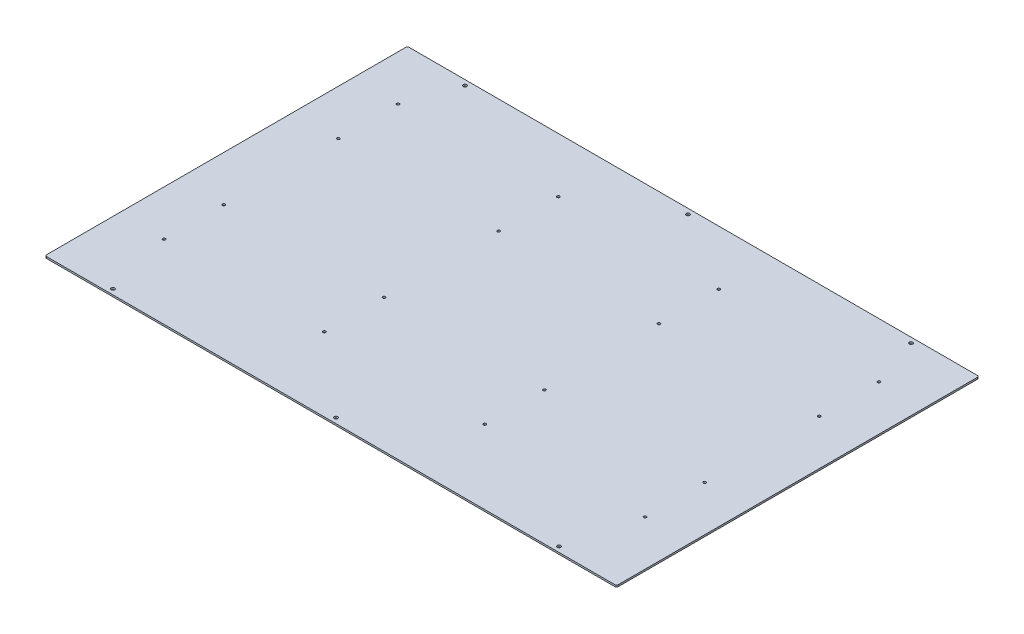
from build123d import *

# Parameters (mm, degrees)
BOSS_EXTRUDE1_DEPTH          = 3.175
F_1_4_0_25_DIAMETER_HOLE1_D  = 6.35
F_10_0_1935_DIAMETER_HOLE1_D = 4.9149


with BuildPart() as part:
    # Sketch1 → Boss-Extrude1 (new body)
    with BuildSketch(Plane(origin=(0, 0, 0), x_dir=(1, 0, 0), z_dir=(0, 1, 0))):
        with BuildLine():
            Line((-517.525, -330.2), (517.525, -330.2))
            ThreePointArc((517.525, -330.2), (519.77006403, -329.27006403), (520.7, -327.025))
            Line((520.7, -327.025), (520.7, 327.025))
            ThreePointArc((520.7, 327.025), (519.77006403, 329.27006403), (517.525, 330.2))
            Line((517.525, 330.2), (-517.525, 330.2))
            ThreePointArc((-517.525, 330.2), (-519.77006403, 329.27006403), (-520.7, 327.025))
            Line((-520.7, 327.025), (-520.7, -327.025))
            ThreePointArc((-520.7, -327.025), (-519.77006403, -329.27006403), (-517.525, -330.2))
        make_face()
    extrude(amount=BOSS_EXTRUDE1_DEPTH)

    # 1/4 (0.25) Diameter Hole1 (through all)
    with Locations(Plane(origin=(0, 3.175, 0), x_dir=(1, 0, 0), z_dir=(0, 1, 0))):
        with Locations((-406.4, 320.675), (0, 320.675), (406.4, 320.675), (406.4, -320.675), (0, -320.675), (-406.4, -320.675)):
            Hole(F_1_4_0_25_DIAMETER_HOLE1_D / 2)

    # #10 (0.1935) Diameter Hole1 (through all)
    with Locations(Plane(origin=(-438.15, 3.175, -230.468256121), x_dir=(0, 0, 1), z_dir=(0, 1, 0))):
        with Locations((0, 0), (108.712, 0), (108.712, 292.1), (0, 292.1), (108.712, 584.2), (0, 584.2), (0, 876.3), (108.712, 876.3), (317.5, 0), (426.212, 0), (426.212, 292.1), (317.5, 292.1), (317.5, 584.2), (426.212, 584.2), (317.5, 876.3), (426.212, 876.3)):
            Hole(F_10_0_1935_DIAMETER_HOLE1_D / 2)


solid = part.part
